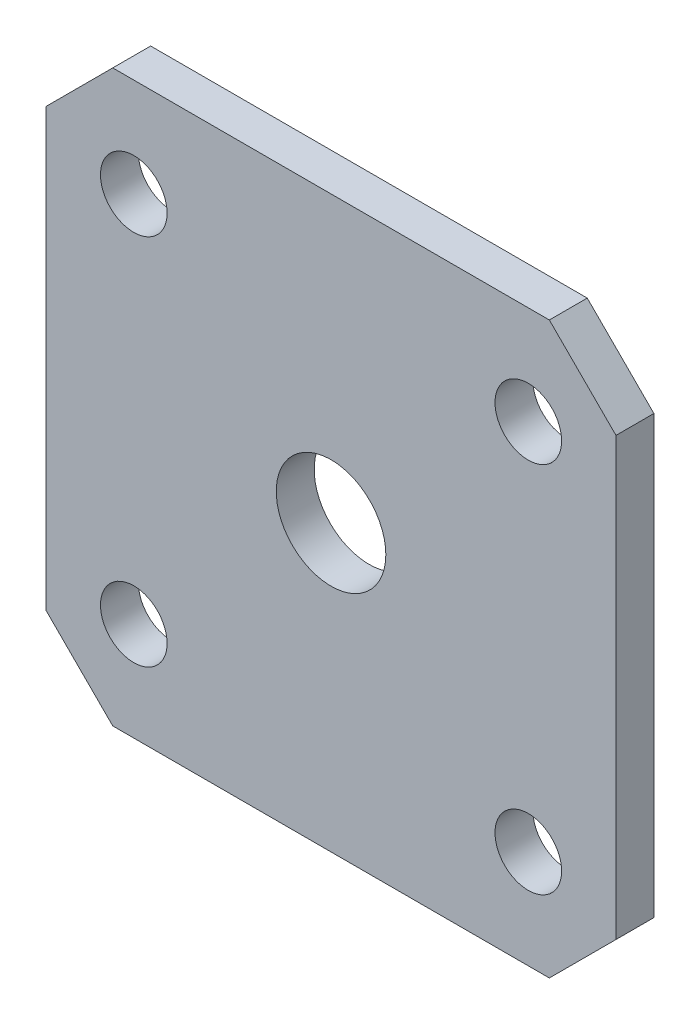
from build123d import *

# Parameters (mm, degrees)
BOSS_EXTRUDE1_DEPTH      = 4.826
BOSS_EXTRUDE1_DEPTH_BACK = 0.666205528
SKETCH1_W                = 82.55
SKETCH1_H                = 82.55
SKETCH1_R                = 4.826
SKETCH1_R_2              = 7.9375
CHAMFER1_SIZE            = 9.652


with BuildPart() as part:
    # Sketch1 → Boss-Extrude1 (new, two sides: drawn at the far end of the back side and taken through both)
    with BuildSketch(Plane(origin=(106.639199962, 25.37693728, 0), x_dir=(1, 0, 0), z_dir=(0, 0, 1)).offset(-BOSS_EXTRUDE1_DEPTH_BACK)):
        with Locations((0, 320.675)):
            Rectangle(SKETCH1_W, SKETCH1_H)
        with Locations((-28.575, 347.6625)):
            Circle(SKETCH1_R, mode=Mode.SUBTRACT)
        with Locations((-28.575, 293.6875)):
            Circle(SKETCH1_R, mode=Mode.SUBTRACT)
        with Locations((28.575, 347.6625)):
            Circle(SKETCH1_R, mode=Mode.SUBTRACT)
        with Locations((28.575, 293.6875)):
            Circle(SKETCH1_R, mode=Mode.SUBTRACT)
        with Locations((0, 320.675)):
            Circle(SKETCH1_R_2, mode=Mode.SUBTRACT)
    extrude(amount=BOSS_EXTRUDE1_DEPTH + BOSS_EXTRUDE1_DEPTH_BACK)

    # Chamfer1
    chamfer1_edges = [part.edges().sort_by_distance(p)[0] for p in [
        (147.914199962, 304.77693728, 2.079897236),
        (65.364199962, 304.77693728, 2.079897236),
        (65.364199962, 387.32693728, 2.079897236),
        (147.914199962, 387.32693728, 2.079897236),
    ]]
    chamfer(chamfer1_edges, length=CHAMFER1_SIZE)


solid = part.part
